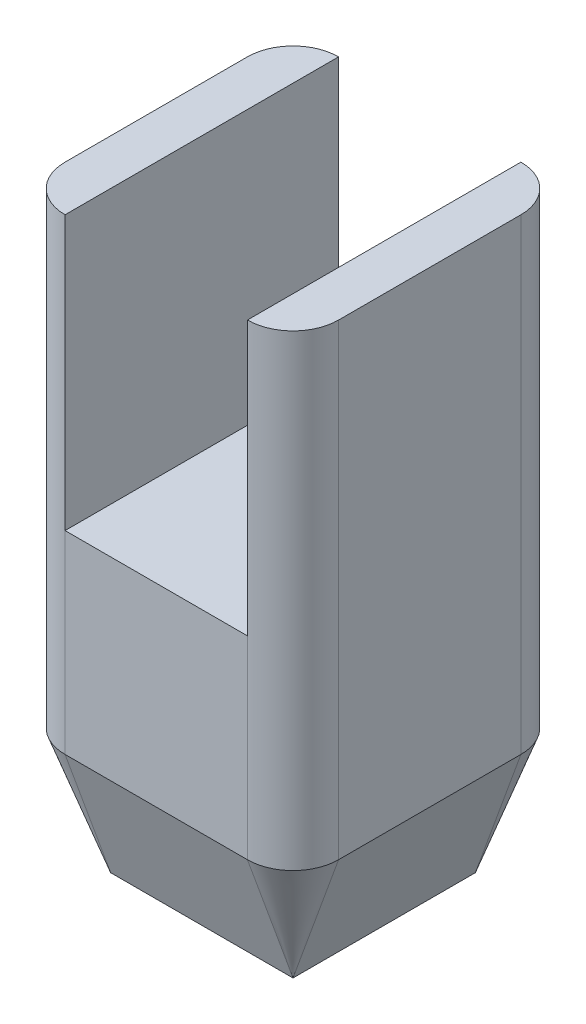
from build123d import *

# Parameters (mm, degrees)
SKETCH1_W           = 3
SKETCH1_H           = 3
BOSS_EXTRUDE1_DEPTH = 3.5
FILLET1_R           = 0.5
CHAMFER1_SIZE       = 0.5
CHAMFER1_SIZE2      = 1.37373871
BOSS_EXTRUDE2_START = 3
BOSS_EXTRUDE2_DEPTH = 3


with BuildPart() as part:
    # Sketch1 → Boss-Extrude1 (new body)
    with BuildSketch(Plane(origin=(0, 0, 0), x_dir=(1, 0, 0), z_dir=(0, 1, 0))):
        Rectangle(SKETCH1_W, SKETCH1_H)
    extrude(amount=BOSS_EXTRUDE1_DEPTH)

    # Fillet1
    fillet1_edges = [part.edges().sort_by_distance(p)[0] for p in [
        (-1.5, 1.75, -1.5),
        (1.5, 1.75, -1.5),
        (1.5, 1.75, 1.5),
        (-1.5, 1.75, 1.5),
    ]]
    fillet(fillet1_edges, radius=FILLET1_R)

    # Chamfer1
    chamfer1_edges = [part.edges().sort_by_distance(p)[0] for p in [
        (-1.5, 0, 0),
        (0, 0, -1.5),
        (1.5, 0, 0),
        (0, 0, 1.5),
        (1.353553391, 0, 1.353553391),
        (-1.353553391, 0, 1.353553391),
        (1.353553391, 0, -1.353553391),
        (-1.353553391, 0, -1.353553391),
    ]]
    chamfer1_side = [part.faces().sort_by_distance(p)[0] for p in [
        (0, 0, 0),
    ]]
    chamfer(chamfer1_edges, length=CHAMFER1_SIZE, length2=CHAMFER1_SIZE2, reference=chamfer1_side[0])

    # Sketch2 → Boss-Extrude2 (add)
    with BuildSketch(Plane(origin=(0, 3.5, 0), x_dir=(1, 0, 0), z_dir=(0, 1, 0)).offset(BOSS_EXTRUDE2_START)):
        with BuildLine():
            Line((-1, 1.5), (-1, -1.5))
            ThreePointArc((-1, -1.5), (-1.353553391, -1.353553391), (-1.5, -1))
            Line((-1.5, -1), (-1.5, 1))
            ThreePointArc((-1.5, 1), (-1.353553391, 1.353553391), (-1, 1.5))
        make_face()
        with BuildLine():
            Line((1.5, -1), (1.5, 1))
            ThreePointArc((1.5, 1), (1.353553391, 1.353553391), (1, 1.5))
            Line((1, 1.5), (1, -1.5))
            ThreePointArc((1, -1.5), (1.353553391, -1.353553391), (1.5, -1))
        make_face()
    extrude(amount=-BOSS_EXTRUDE2_DEPTH)


solid = part.part
